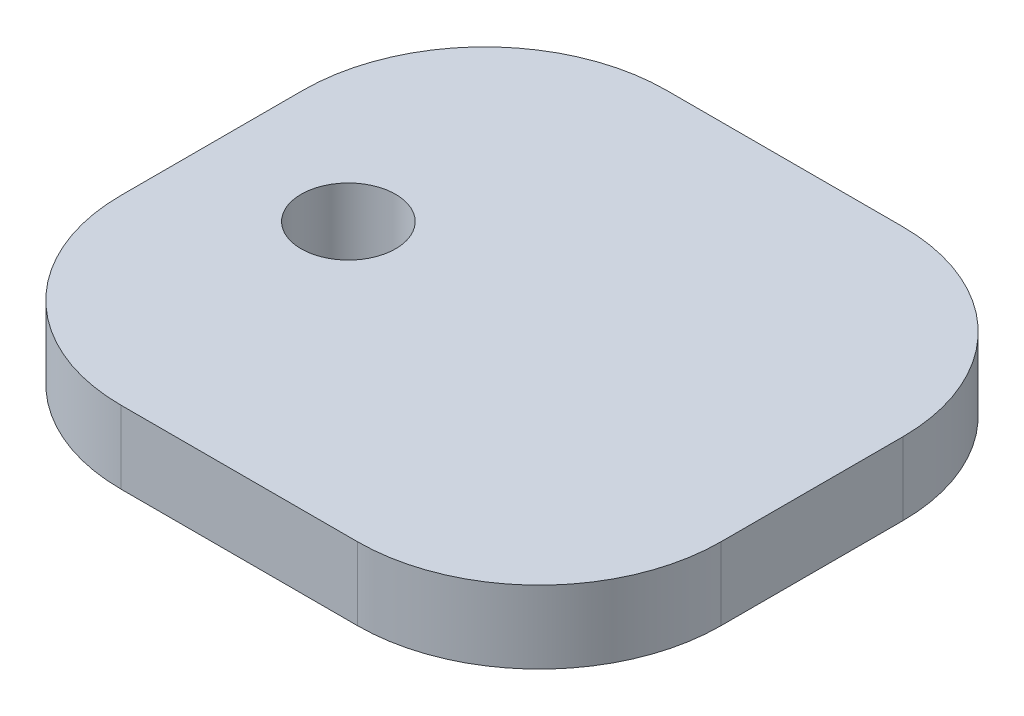
from build123d import *

# Parameters (mm, degrees)
SKETCH1_W           = 33
SKETCH1_H           = 30
SKETCH1_R           = 2.6
BOSS_EXTRUDE1_DEPTH = 4
FILLET1_R           = 10


with BuildPart() as part:
    # Sketch1 → Boss-Extrude1 (new body)
    with BuildSketch(Plane(origin=(0, 0, 0), x_dir=(1, 0, 0), z_dir=(0, 1, 0))):
        with Locations((-3, 0)):
            Rectangle(SKETCH1_W, SKETCH1_H)
        with Locations(Location((-12, 0, 0), (0, 0, 270))):
            Circle(SKETCH1_R, mode=Mode.SUBTRACT)
    extrude(amount=BOSS_EXTRUDE1_DEPTH)

    # Fillet1
    fillet1_edges = [part.edges().sort_by_distance(p)[0] for p in [
        (13.5, 2, 15),
        (-19.5, 2, 15),
        (-19.5, 2, -15),
        (13.5, 2, -15),
    ]]
    fillet(fillet1_edges, radius=FILLET1_R)


solid = part.part
